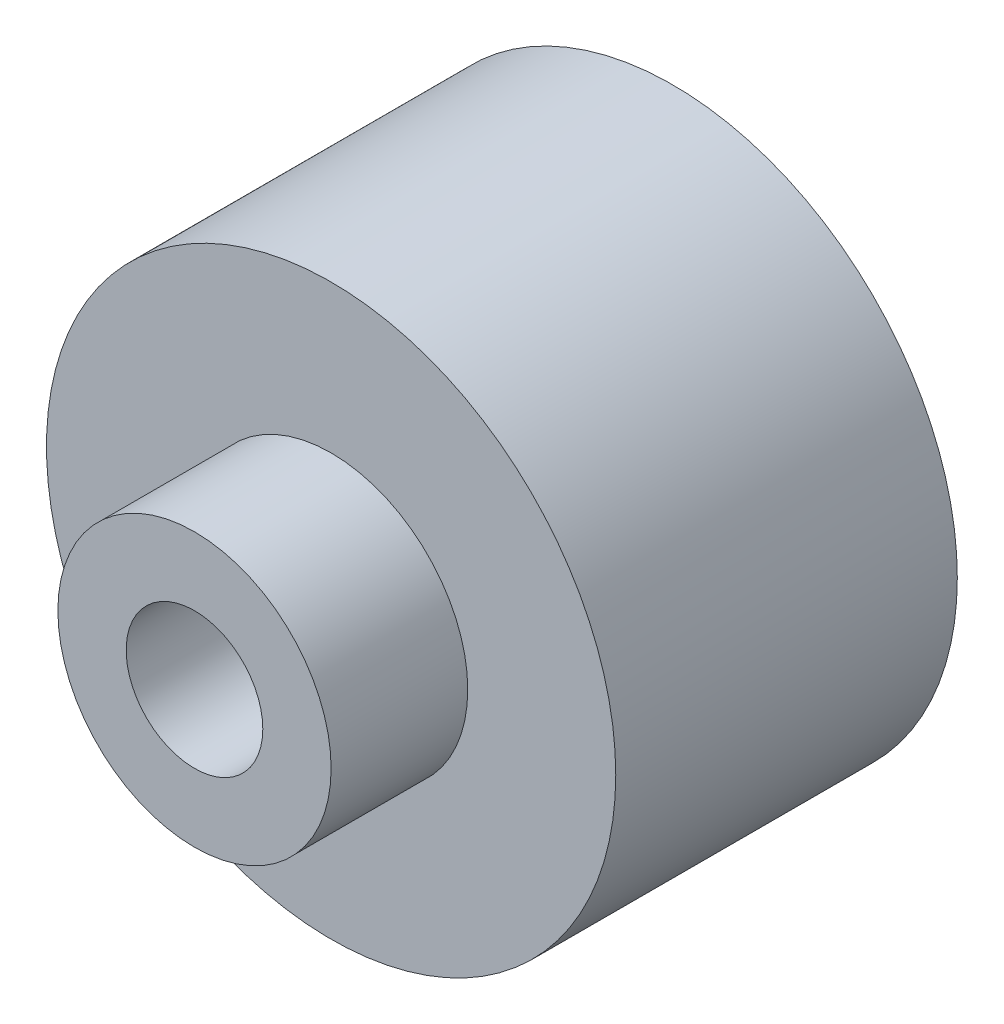
from build123d import *


with BuildPart() as part:
    # Эскиз1 → Повернуть1 (revolve)
    with BuildSketch(Plane(origin=(0, 0, 0), x_dir=(1, 0, 0), z_dir=(0, 1, 0))):
        Polygon((3, 0), (3, -21), (6, -21), (6, -15), (12.5, -15), (12.5, 0), align=None)
    revolve(axis=Axis((0, 0, 0), (0, 0, 1)))


solid = part.part
